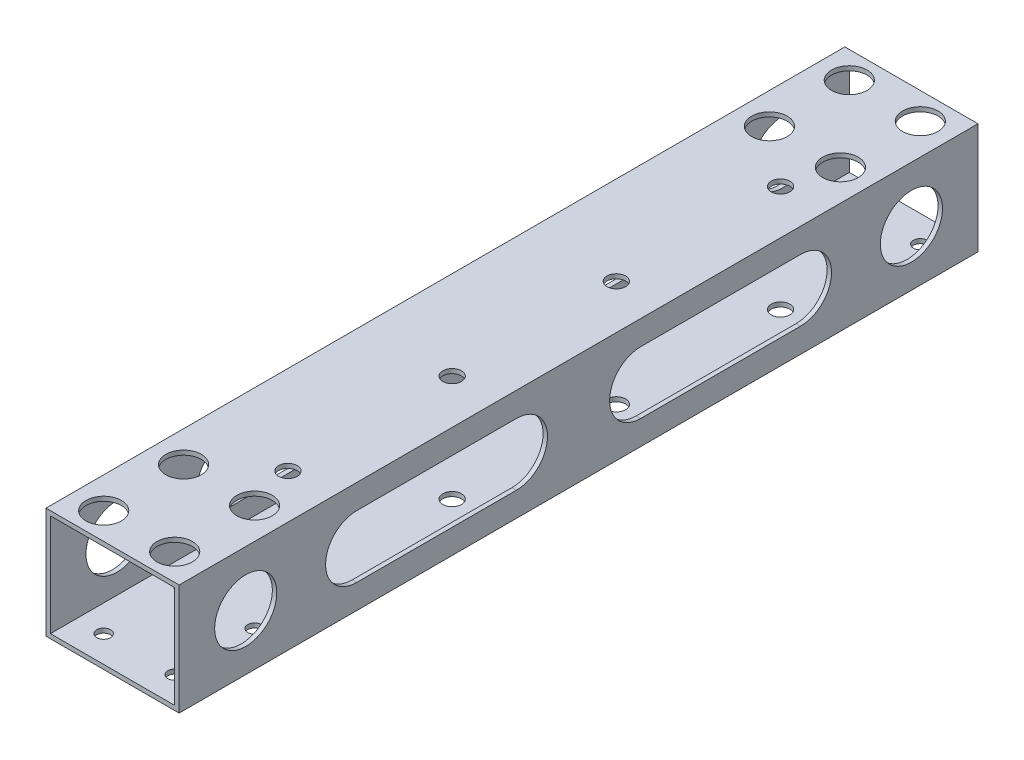
from build123d import *

# Parameters (mm, degrees)
SKETCH_1_W          = 30
SKETCH_1_H          = 25
SKETCH_1_W_2        = 28
SKETCH_1_H_2        = 23
EXTRUDE_1_DEPTH     = 90
SKETCH_2_R          = 2.1
CUT_EXTRUDE_1_DEPTH = 30
SKETCH_3_R          = 1.55
CUT_EXTRUDE_2_DEPTH = 30
SKETCH_4_R          = 4
CUT_EXTRUDE_3_DEPTH = 10
SKETCH_5_R          = 7
CUT_EXTRUDE_4_DEPTH = 30


with BuildPart() as part:
    # 草图1 → 凸台-拉伸1 (new, symmetric)
    with BuildSketch(Plane.XY):
        Rectangle(SKETCH_1_W, SKETCH_1_H)
        Rectangle(SKETCH_1_W_2, SKETCH_1_H_2, mode=Mode.SUBTRACT)
    extrude(amount=EXTRUDE_1_DEPTH, both=True)

    # 草图2 → 切除-拉伸1 (cut)
    with BuildSketch(Plane(origin=(0, 12.5, 0), x_dir=(1, 0, 0), z_dir=(0, 1, 0))):
        with Locations(Location((5, 55.51, 0), (0, 0, 180))):
            Circle(SKETCH_2_R)
        with Locations(Location((5, -55.49, 0), (0, 0, 180))):
            Circle(SKETCH_2_R)
        with Locations(Location((5, -18.49, 0), (0, 0, 180))):
            Circle(SKETCH_2_R)
        with Locations(Location((5, 18.51, 0), (0, 0, 180))):
            Circle(SKETCH_2_R)
    extrude(amount=-CUT_EXTRUDE_1_DEPTH, mode=Mode.SUBTRACT)

    # 草图3 → 切除-拉伸2 (cut)
    with BuildSketch(Plane(origin=(0, 12.5, 0), x_dir=(1, 0, 0), z_dir=(0, 1, 0))):
        with Locations(Location((8, 84, 0), (0, 0, 180))):
            Circle(SKETCH_3_R)
        with Locations(Location((8, 66, 0), (0, 0, 180))):
            Circle(SKETCH_3_R)
        with Locations(Location((-8, 84, 0), (0, 0, 180))):
            Circle(SKETCH_3_R)
        with Locations(Location((-8, 66, 0), (0, 0, 180))):
            Circle(SKETCH_3_R)
        with Locations(Location((8, -66, 0), (0, 0, 180))):
            Circle(SKETCH_3_R)
        with Locations(Location((-8, -66, 0), (0, 0, 180))):
            Circle(SKETCH_3_R)
        with Locations(Location((-8, -84, 0), (0, 0, 180))):
            Circle(SKETCH_3_R)
        with Locations(Location((8, -84, 0), (0, 0, 180))):
            Circle(SKETCH_3_R)
    extrude(amount=-CUT_EXTRUDE_2_DEPTH, mode=Mode.SUBTRACT)

    # 草图4 → 切除-拉伸3 (cut)
    with BuildSketch(Plane(origin=(0, 12.5, 0), x_dir=(1, 0, 0), z_dir=(0, 1, 0))):
        with Locations(Location((8, -84, 0), (0, 0, 180))):
            Circle(SKETCH_4_R)
        with Locations(Location((-8, -84, 0), (0, 0, 180))):
            Circle(SKETCH_4_R)
        with Locations(Location((-8, -66, 0), (0, 0, 180))):
            Circle(SKETCH_4_R)
        with Locations(Location((8, -66, 0), (0, 0, 180))):
            Circle(SKETCH_4_R)
        with Locations(Location((-8, 66, 0), (0, 0, 180))):
            Circle(SKETCH_4_R)
        with Locations(Location((8, 66, 0), (0, 0, 180))):
            Circle(SKETCH_4_R)
        with Locations(Location((8, 84, 0), (0, 0, 180))):
            Circle(SKETCH_4_R)
        with Locations(Location((-8, 84, 0), (0, 0, 180))):
            Circle(SKETCH_4_R)
    extrude(amount=-CUT_EXTRUDE_3_DEPTH, mode=Mode.SUBTRACT)

    # 草图5 → 切除-拉伸4 (cut)
    with BuildSketch(Plane.ZY.offset(15)):
        with Locations(Location((75, 0, 0), (0, 0, 270))):
            Circle(SKETCH_5_R)
        with Locations(Location((-75, 0, 0), (0, 0, 180))):
            Circle(SKETCH_5_R)
        with BuildLine():
            Line((14, 7), (50, 7))
            ThreePointArc((50, 7), (57, 0), (50, -7))
            Line((50, -7), (14, -7))
            ThreePointArc((14, -7), (7, 0), (14, 7))
        make_face()
        with BuildLine():
            Line((-14, 7), (-50, 7))
            ThreePointArc((-50, 7), (-57, 0), (-50, -7))
            Line((-50, -7), (-14, -7))
            ThreePointArc((-14, -7), (-7, 0), (-14, 7))
        make_face()
    extrude(amount=-CUT_EXTRUDE_4_DEPTH, mode=Mode.SUBTRACT)


solid = part.part
